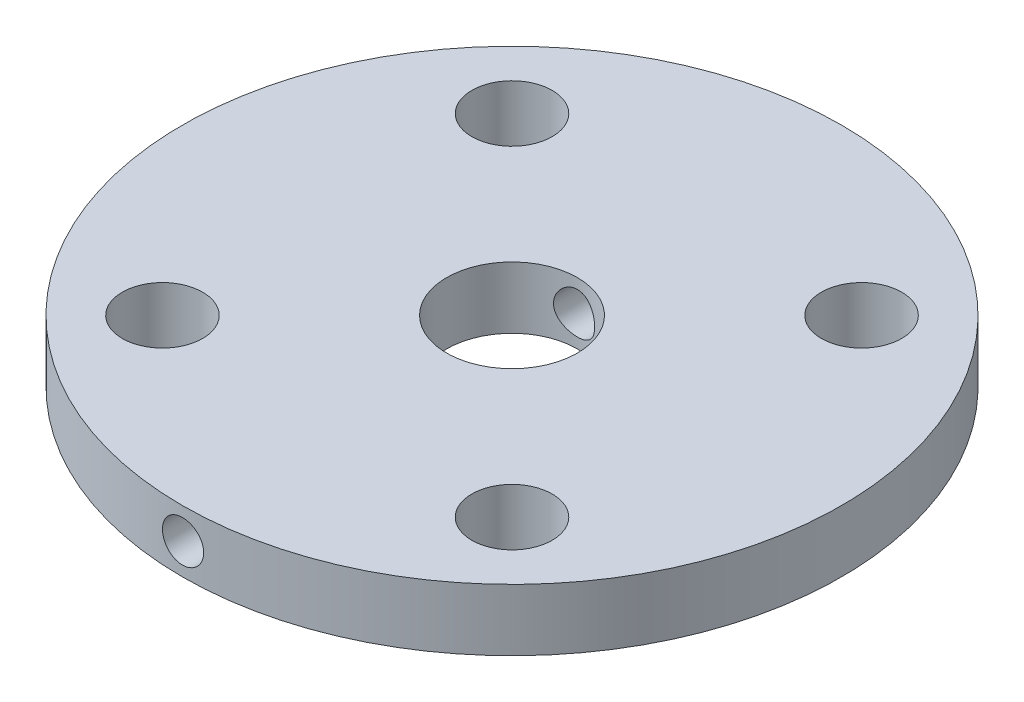
from build123d import *

# Parameters (mm, degrees)
SKETCH1_R             = 16
BOSS_EXTRUDE1_DEPTH   = 3
F_3_0MM_DOWEL_HOLE1_D = 3.9
SKETCH6_R             = 3.175
CUT_EXTRUDE3_DEPTH    = 23.825424421
SKETCH14_R            = 1
CUT_EXTRUDE4_DEPTH    = 40
SKETCH7_R             = 1
CUT_EXTRUDE1_DEPTH    = 10.5
SKETCH11_R            = 1.9
CUT_EXTRUDE2_DEPTH    = 2


with BuildPart() as part:
    # Sketch1 → Boss-Extrude1 (new body)
    with BuildSketch(Plane(origin=(0, 0, 0), x_dir=(1, 0, 0), z_dir=(0, 1, 0))):
        with Locations(Location((0, 0, 0), (0, 0, 270))):
            Circle(SKETCH1_R)
    extrude(amount=BOSS_EXTRUDE1_DEPTH)

    # Ø3.0mm Dowel Hole1 (through all)
    with Locations(Plane(origin=(8.485281374, 3, 8.485281374), x_dir=(0, 0, 1), z_dir=(0, 1, 0))):
        with Locations((0, 0), (0, -16.970562748), (-16.970562748, -16.970562748), (-16.970562748, 0)):
            Hole(F_3_0MM_DOWEL_HOLE1_D / 2)

    # Sketch6 → Cut-Extrude3 (cut, through all)
    with BuildSketch(Plane.XZ):
        with Locations(Location((0, 0, 0), (0, 0, 270))):
            Circle(SKETCH6_R)
    extrude(amount=-CUT_EXTRUDE3_DEPTH, mode=Mode.SUBTRACT)

    # Sketch14 → Cut-Extrude4 (cut)
    with BuildSketch(Plane.XY.offset(16)):
        with Locations((0, 1.5)):
            Circle(SKETCH14_R)
    extrude(amount=-CUT_EXTRUDE4_DEPTH, mode=Mode.SUBTRACT)

    # Sketch7 → Cut-Extrude1 (cut)
    with BuildSketch(Plane.XY):
        with Locations((0, -5)):
            Circle(SKETCH7_R)
    extrude(amount=CUT_EXTRUDE1_DEPTH, mode=Mode.SUBTRACT)

    # Sketch11 → Cut-Extrude2 (cut)
    with BuildSketch(Plane.XY.offset(7)):
        with Locations((0, -5)):
            Circle(SKETCH11_R)
    extrude(amount=-CUT_EXTRUDE2_DEPTH, mode=Mode.SUBTRACT)


solid = part.part
